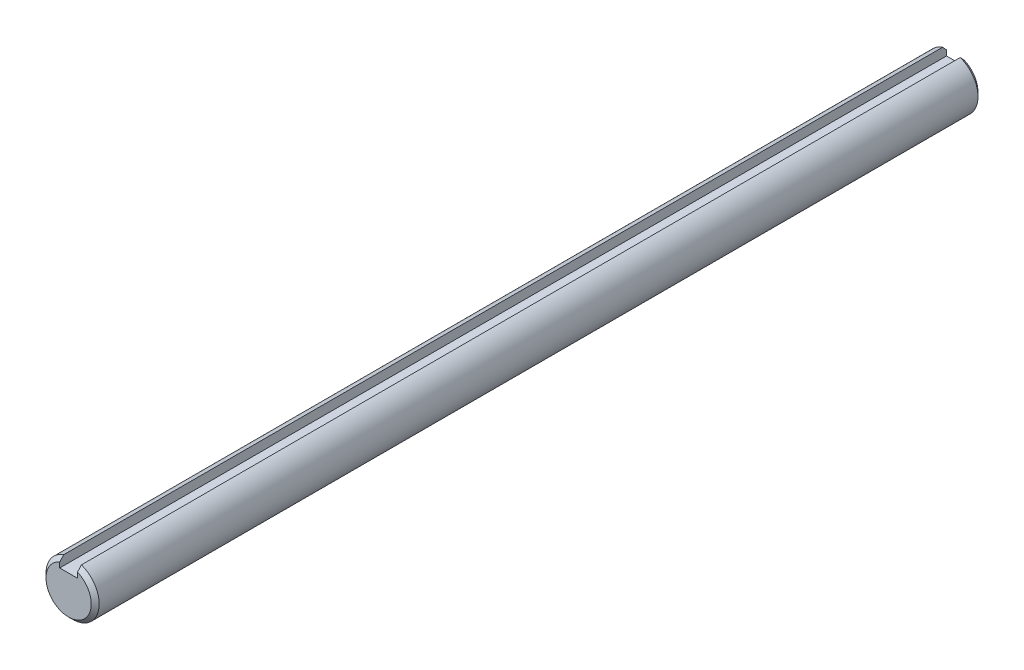
from build123d import *

# Parameters (mm, degrees)
SKETCH1_R           = 6
EXTRUDE1_DEPTH      = 100
CHAMFER1_SIZE       = 0.9
EXTRUDE2_DEPTH      = 101.359354322
EXTRUDE2_DEPTH_BACK = 101.359354322
SKETCH3_W           = 4
SKETCH3_H           = 2.5


with BuildPart() as part:
    # Sketch1 → Extrude1 (new, symmetric)
    with BuildSketch(Plane.XY):
        Circle(SKETCH1_R)
    extrude(amount=EXTRUDE1_DEPTH, both=True)

    # Chamfer1
    chamfer1_edges = [part.edges().sort_by_distance(p)[0] for p in [
        (-6, 0, -100),
        (-6, 0, 100),
    ]]
    chamfer(chamfer1_edges, length=CHAMFER1_SIZE)

    # Sketch3 → Extrude2 (cut, two sides: drawn at the far end of the back side and taken through both)
    with BuildSketch(Plane.XY.offset(-EXTRUDE2_DEPTH_BACK)):
        with Locations((0, 4.75)):
            Rectangle(SKETCH3_W, SKETCH3_H)
    extrude(amount=EXTRUDE2_DEPTH + EXTRUDE2_DEPTH_BACK, mode=Mode.SUBTRACT)


solid = part.part
